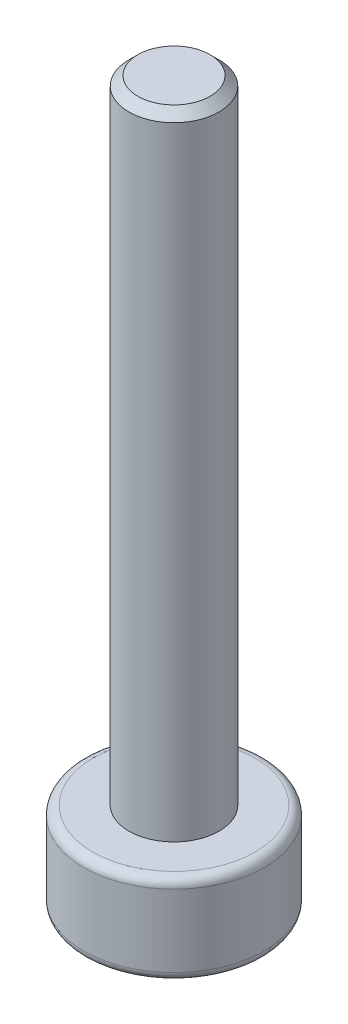
from build123d import *

# Parameters (mm, degrees)
SKETCH_2_R          = 2
EXTRUDE_1_DEPTH     = 2
SKETCH_3_R          = 1
EXTRUDE_2_DEPTH     = 14
FILLET_1_R          = 0.2
SKETCH_4_R          = 0.765
CUT_EXTRUDE_1_DEPTH = 1.52
CHAMFER_1_SIZE      = 0.1
CHAMFER_2_SIZE      = 0.2


with BuildPart() as part:
    # 草图2 → 凸台-拉伸1 (new body)
    with BuildSketch(Plane(origin=(0, 0, 0), x_dir=(1, 0, 0), z_dir=(0, 1, 0))):
        with Locations(Location((0, 0, 0), (0, 0, 270))):
            Circle(SKETCH_2_R)
    extrude(amount=EXTRUDE_1_DEPTH)

    # 草图3 → 凸台-拉伸2 (add)
    with BuildSketch(Plane(origin=(0, 2, 0), x_dir=(1, 0, 0), z_dir=(0, 1, 0))):
        with Locations(Location((0, 0, 0), (0, 0, 270))):
            Circle(SKETCH_3_R)
    extrude(amount=EXTRUDE_2_DEPTH)

    # 圆角1
    fillet_1_edges = [part.edges().sort_by_distance(p)[0] for p in [
        (0, 0, -2),
        (0, 2, -2),
    ]]
    fillet(fillet_1_edges, radius=FILLET_1_R)

    # 草图4 → 切除-拉伸1 (cut)
    with BuildSketch(Plane.XZ):
        with Locations(Location((0, 0, 0), (0, 0, 270))):
            Circle(SKETCH_4_R)
    extrude(amount=-CUT_EXTRUDE_1_DEPTH, mode=Mode.SUBTRACT)

    # 倒角1
    chamfer_1_edges = [part.edges().sort_by_distance(p)[0] for p in [
        (0, 0, 0.765),
    ]]
    chamfer(chamfer_1_edges, length=CHAMFER_1_SIZE)

    # 倒角2
    chamfer_2_edges = [part.edges().sort_by_distance(p)[0] for p in [
        (0, 16, -1),
    ]]
    chamfer(chamfer_2_edges, length=CHAMFER_2_SIZE)


solid = part.part
